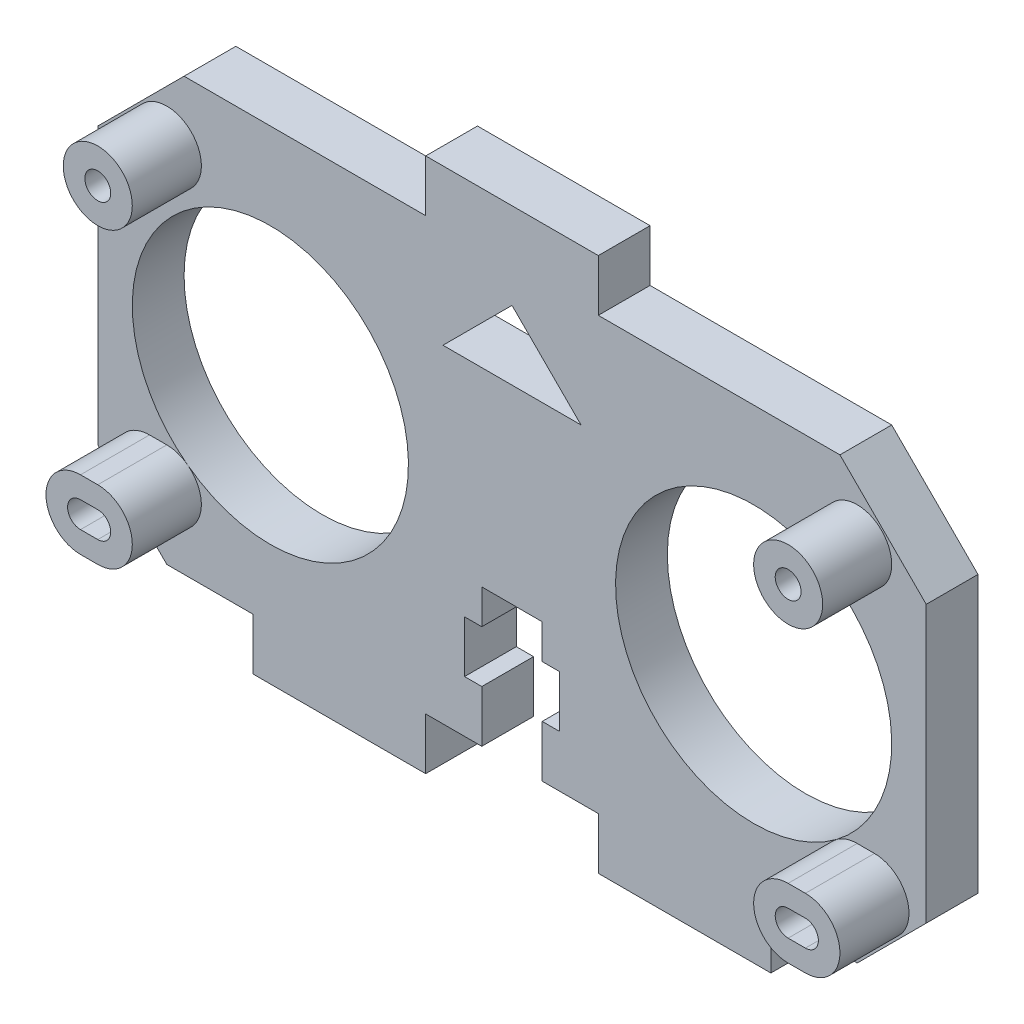
from build123d import *

# Parameters (mm, degrees)
ESQUISSE1_W              = 48
ESQUISSE1_H              = 31
BOSS_EXTRU_1_DEPTH       = 3
ENL_V_MAT_EXTRU_2_REACH  = 59.219
ESQUISSE3_W              = 10
ESQUISSE3_H              = 3
ENL_V_MAT_EXTRU_3_REACH  = 59.219
ESQUISSE4_W              = 5.5
ESQUISSE4_H              = 3
ENL_V_START              = -3
ESQUISSE5_W              = 3.5
ESQUISSE5_H              = 11
ENL_V_MAT_EXTRU_4_DEPTH  = 3
ENL_V_MAT_EXTRU_7_REACH  = 59.219
ESQUISSE8_W              = 5
ESQUISSE8_H              = 3
ENL_V_MAT_EXTRU_8_REACH  = 59.219
ESQUISSE9_W              = 5
ESQUISSE9_H              = 3
ENL_V_MAT_EXTRU_14_REACH = 59.219
ESQUISSE18_W             = 4
ESQUISSE18_H             = 3
ENL_V_MAT_EXTRU_19_REACH = 59.219
ESQUISSE23_W             = 4
ESQUISSE23_H             = 3
ENL_V_MAT_EXTRU_20_REACH = 59.219
ENL_V_MAT_EXTRU_21_REACH = 59.219
ESQUISSE25_W             = 19
ESQUISSE25_H             = 3
ENL_V_MAT_EXTRU_22_REACH = 59.219
ESQUISSE26_W             = 19
ESQUISSE26_H             = 3
ENL_V_MAT_EXTRU_23_REACH = 59.219
ESQUISSE27_R             = 8
ENL_V_MAT_EXTRU_24_REACH = 59.219
ESQUISSE28_R             = 8
ESQUISSE29_R             = 2
BOSS_EXTRU_5_DEPTH       = 4
ESQUISSE30_R             = 2
BOSS_EXTRU_6_DEPTH       = 4
ENL_V_MAT_EXTRU_25_REACH = 59.567
ESQUISSE31_R             = 0.75
ENL_V_MAT_EXTRU_26_REACH = 59.567
ESQUISSE32_R             = 0.75
BOSS_EXTRU_7_DEPTH       = 4
BOSS_EXTRU_8_DEPTH       = 4
ENL_V_MAT_EXTRU_27_REACH = 59.567
ENL_V_MAT_EXTRU_29_REACH = 59.567
CHANFREIN4_SIZE          = 5
CHANFREIN5_SIZE          = 4


with BuildPart() as part:
    # Esquisse1 → Boss.-Extru.1 (new body)
    with BuildSketch(Plane.XY):
        with Locations((24, 15.5)):
            Rectangle(ESQUISSE1_W, ESQUISSE1_H)
    extrude(amount=BOSS_EXTRU_1_DEPTH)

    # Esquisse3 → Enlèv. mat.-Extru.2 (cut, up to next)
    with BuildSketch(Plane.XY.offset(3), mode=Mode.PRIVATE) as enl_v_mat_extru_2_sk1:
        with Locations((24, 1.5)):
            Rectangle(ESQUISSE3_W, ESQUISSE3_H)
    enl_v_mat_extru_2_tool1 = extrude(enl_v_mat_extru_2_sk1.sketch, amount=-ENL_V_MAT_EXTRU_2_REACH, mode=Mode.PRIVATE) & part.part
    add(enl_v_mat_extru_2_tool1.solids().sort_by_distance((24, 1.5, 3))[0], mode=Mode.SUBTRACT)

    # Esquisse4 → Enlèv. mat.-Extru.3 (cut, up to next)
    with BuildSketch(Plane.XY.offset(3), mode=Mode.PRIVATE) as enl_v_mat_extru_3_sk1:
        with Locations((24, 7.5)):
            Rectangle(ESQUISSE4_W, ESQUISSE4_H)
    enl_v_mat_extru_3_tool1 = extrude(enl_v_mat_extru_3_sk1.sketch, amount=-ENL_V_MAT_EXTRU_3_REACH, mode=Mode.PRIVATE) & part.part
    add(enl_v_mat_extru_3_tool1.solids().sort_by_distance((24, 7.5, 3))[0], mode=Mode.SUBTRACT)

    # Esquisse5 → Enlèv. mat.-Extru.4 (cut)
    with BuildSketch(Plane.XY.offset(3).offset(ENL_V_START)):
        with Locations((24, 5.5)):
            Rectangle(ESQUISSE5_W, ESQUISSE5_H)
    extrude(amount=ENL_V_MAT_EXTRU_4_DEPTH, mode=Mode.SUBTRACT)

    # Esquisse8 → Enlèv. mat.-Extru.7 (cut, up to next)
    with BuildSketch(Plane.XY.offset(3), mode=Mode.PRIVATE) as enl_v_mat_extru_7_sk1:
        with Locations((2.5, 1.5)):
            Rectangle(ESQUISSE8_W, ESQUISSE8_H)
    enl_v_mat_extru_7_tool1 = extrude(enl_v_mat_extru_7_sk1.sketch, amount=-ENL_V_MAT_EXTRU_7_REACH, mode=Mode.PRIVATE) & part.part
    add(enl_v_mat_extru_7_tool1.solids().sort_by_distance((2.5, 1.5, 3))[0], mode=Mode.SUBTRACT)

    # Esquisse9 → Enlèv. mat.-Extru.8 (cut, up to next)
    with BuildSketch(Plane.XY.offset(3), mode=Mode.PRIVATE) as enl_v_mat_extru_8_sk1:
        with Locations((45.5, 1.5)):
            Rectangle(ESQUISSE9_W, ESQUISSE9_H)
    enl_v_mat_extru_8_tool1 = extrude(enl_v_mat_extru_8_sk1.sketch, amount=-ENL_V_MAT_EXTRU_8_REACH, mode=Mode.PRIVATE) & part.part
    add(enl_v_mat_extru_8_tool1.solids().sort_by_distance((45.5, 1.5, 3))[0], mode=Mode.SUBTRACT)

    # Esquisse18 → Enlèv. mat.-Extru.14 (cut, up to next)
    with BuildSketch(Plane.XY.offset(3), mode=Mode.PRIVATE) as enl_v_mat_extru_14_sk1:
        with Locations((41, 1.5)):
            Rectangle(ESQUISSE18_W, ESQUISSE18_H)
    enl_v_mat_extru_14_tool1 = extrude(enl_v_mat_extru_14_sk1.sketch, amount=-ENL_V_MAT_EXTRU_14_REACH, mode=Mode.PRIVATE) & part.part
    add(enl_v_mat_extru_14_tool1.solids().sort_by_distance((41, 1.5, 3))[0], mode=Mode.SUBTRACT)

    # Esquisse23 → Enlèv. mat.-Extru.19 (cut, up to next)
    with BuildSketch(Plane.XY.offset(3), mode=Mode.PRIVATE) as enl_v_mat_extru_19_sk1:
        with Locations((7, 1.5)):
            Rectangle(ESQUISSE23_W, ESQUISSE23_H)
    enl_v_mat_extru_19_tool1 = extrude(enl_v_mat_extru_19_sk1.sketch, amount=-ENL_V_MAT_EXTRU_19_REACH, mode=Mode.PRIVATE) & part.part
    add(enl_v_mat_extru_19_tool1.solids().sort_by_distance((7, 1.5, 3))[0], mode=Mode.SUBTRACT)

    # Esquisse24 → Enlèv. mat.-Extru.20 (cut, up to next)
    with BuildSketch(Plane.XY.offset(3), mode=Mode.PRIVATE) as enl_v_mat_extru_20_sk1:
        Polygon((20, 22), (24, 26), (28, 22), align=None)
    enl_v_mat_extru_20_tool1 = extrude(enl_v_mat_extru_20_sk1.sketch, amount=-ENL_V_MAT_EXTRU_20_REACH, mode=Mode.PRIVATE) & part.part
    add(enl_v_mat_extru_20_tool1.solids().sort_by_distance((24, 23.333333, 3))[0], mode=Mode.SUBTRACT)

    # Esquisse25 → Enlèv. mat.-Extru.21 (cut, up to next)
    with BuildSketch(Plane.XY.offset(3), mode=Mode.PRIVATE) as enl_v_mat_extru_21_sk1:
        with Locations((38.5, 29.5)):
            Rectangle(ESQUISSE25_W, ESQUISSE25_H)
    enl_v_mat_extru_21_tool1 = extrude(enl_v_mat_extru_21_sk1.sketch, amount=-ENL_V_MAT_EXTRU_21_REACH, mode=Mode.PRIVATE) & part.part
    add(enl_v_mat_extru_21_tool1.solids().sort_by_distance((38.5, 29.5, 3))[0], mode=Mode.SUBTRACT)

    # Esquisse26 → Enlèv. mat.-Extru.22 (cut, up to next)
    with BuildSketch(Plane.XY.offset(3), mode=Mode.PRIVATE) as enl_v_mat_extru_22_sk1:
        with Locations((9.5, 29.5)):
            Rectangle(ESQUISSE26_W, ESQUISSE26_H)
    enl_v_mat_extru_22_tool1 = extrude(enl_v_mat_extru_22_sk1.sketch, amount=-ENL_V_MAT_EXTRU_22_REACH, mode=Mode.PRIVATE) & part.part
    add(enl_v_mat_extru_22_tool1.solids().sort_by_distance((9.5, 29.5, 3))[0], mode=Mode.SUBTRACT)

    # Esquisse27 → Enlèv. mat.-Extru.23 (cut, up to next)
    with BuildSketch(Plane.XY.offset(3), mode=Mode.PRIVATE) as enl_v_mat_extru_23_sk1:
        with Locations((38, 15)):
            Circle(ESQUISSE27_R)
    enl_v_mat_extru_23_tool1 = extrude(enl_v_mat_extru_23_sk1.sketch, amount=-ENL_V_MAT_EXTRU_23_REACH, mode=Mode.PRIVATE) & part.part
    add(enl_v_mat_extru_23_tool1.solids().sort_by_distance((38, 15, 3))[0], mode=Mode.SUBTRACT)

    # Esquisse28 → Enlèv. mat.-Extru.24 (cut, up to next)
    with BuildSketch(Plane.XY.offset(3), mode=Mode.PRIVATE) as enl_v_mat_extru_24_sk1:
        with Locations((10, 15)):
            Circle(ESQUISSE28_R)
    enl_v_mat_extru_24_tool1 = extrude(enl_v_mat_extru_24_sk1.sketch, amount=-ENL_V_MAT_EXTRU_24_REACH, mode=Mode.PRIVATE) & part.part
    add(enl_v_mat_extru_24_tool1.solids().sort_by_distance((10, 15, 3))[0], mode=Mode.SUBTRACT)

    # Esquisse29 → Boss.-Extru.5 (add)
    with BuildSketch(Plane.XY.offset(3)):
        with Locations(Location((4, 24, 0), (0, 0, 180))):
            Circle(ESQUISSE29_R)
    extrude(amount=BOSS_EXTRU_5_DEPTH)

    # Esquisse30 → Boss.-Extru.6 (add)
    with BuildSketch(Plane.XY.offset(3)):
        with Locations(Location((44, 24, 0), (0, 0, 180))):
            Circle(ESQUISSE30_R)
    extrude(amount=BOSS_EXTRU_6_DEPTH)

    # Esquisse31 → Enlèv. mat.-Extru.25 (cut, up to next)
    with BuildSketch(Plane.XY.offset(7), mode=Mode.PRIVATE) as enl_v_mat_extru_25_sk1:
        with Locations((4, 24)):
            Circle(ESQUISSE31_R)
    enl_v_mat_extru_25_tool1 = extrude(enl_v_mat_extru_25_sk1.sketch, amount=-ENL_V_MAT_EXTRU_25_REACH, mode=Mode.PRIVATE) & part.part
    add(enl_v_mat_extru_25_tool1.solids().sort_by_distance((4, 24, 7))[0], mode=Mode.SUBTRACT)

    # Esquisse32 → Enlèv. mat.-Extru.26 (cut, up to next)
    with BuildSketch(Plane.XY.offset(7), mode=Mode.PRIVATE) as enl_v_mat_extru_26_sk1:
        with Locations((44, 24)):
            Circle(ESQUISSE32_R)
    enl_v_mat_extru_26_tool1 = extrude(enl_v_mat_extru_26_sk1.sketch, amount=-ENL_V_MAT_EXTRU_26_REACH, mode=Mode.PRIVATE) & part.part
    add(enl_v_mat_extru_26_tool1.solids().sort_by_distance((44, 24, 7))[0], mode=Mode.SUBTRACT)

    # Esquisse33 → Boss.-Extru.7 (add)
    with BuildSketch(Plane.XY.offset(3)):
        with BuildLine():
            Line((3, 9), (4, 9))
            ThreePointArc((4, 9), (6, 7), (4, 5))
            Line((4, 5), (3, 5))
            ThreePointArc((3, 5), (1, 7), (3, 9))
        make_face()
    extrude(amount=BOSS_EXTRU_7_DEPTH)

    # Esquisse34 → Boss.-Extru.8 (add)
    with BuildSketch(Plane.XY.offset(3)):
        with BuildLine():
            Line((44, 9), (45, 9))
            ThreePointArc((45, 9), (47, 7), (45, 5))
            Line((45, 5), (44, 5))
            ThreePointArc((44, 5), (42, 7), (44, 9))
        make_face()
    extrude(amount=BOSS_EXTRU_8_DEPTH)

    # Esquisse35 → Enlèv. mat.-Extru.27 (cut, up to next)
    with BuildSketch(Plane.XY.offset(7), mode=Mode.PRIVATE) as enl_v_mat_extru_27_sk1:
        with BuildLine():
            Line((3, 7.75), (4, 7.75))
            ThreePointArc((4, 7.75), (4.75, 7), (4, 6.25))
            Line((4, 6.25), (3, 6.25))
            ThreePointArc((3, 6.25), (2.25, 7), (3, 7.75))
        make_face()
    enl_v_mat_extru_27_tool1 = extrude(enl_v_mat_extru_27_sk1.sketch, amount=-ENL_V_MAT_EXTRU_27_REACH, mode=Mode.PRIVATE) & part.part
    add(enl_v_mat_extru_27_tool1.solids().sort_by_distance((3.5, 7, 7))[0], mode=Mode.SUBTRACT)

    # Esquisse37 → Enlèv. mat.-Extru.29 (cut, up to next)
    with BuildSketch(Plane.XY.offset(7), mode=Mode.PRIVATE) as enl_v_mat_extru_29_sk1:
        with BuildLine():
            Line((44, 7.75), (45, 7.75))
            ThreePointArc((45, 7.75), (45.75, 7), (45, 6.25))
            Line((45, 6.25), (44, 6.25))
            ThreePointArc((44, 6.25), (43.25, 7), (44, 7.75))
        make_face()
    enl_v_mat_extru_29_tool1 = extrude(enl_v_mat_extru_29_sk1.sketch, amount=-ENL_V_MAT_EXTRU_29_REACH, mode=Mode.PRIVATE) & part.part
    add(enl_v_mat_extru_29_tool1.solids().sort_by_distance((44.5, 7, 7))[0], mode=Mode.SUBTRACT)

    # Chanfrein4
    chanfrein4_edges = [part.edges().sort_by_distance(p)[0] for p in [
        (48, 28, 1.5),
        (0, 28, 1.5),
    ]]
    chamfer(chanfrein4_edges, length=CHANFREIN4_SIZE)

    # Chanfrein5
    chanfrein5_edges = [part.edges().sort_by_distance(p)[0] for p in [
        (0, 3, 1.5),
        (48, 3, 1.5),
    ]]
    chamfer(chanfrein5_edges, length=CHANFREIN5_SIZE)


solid = part.part
